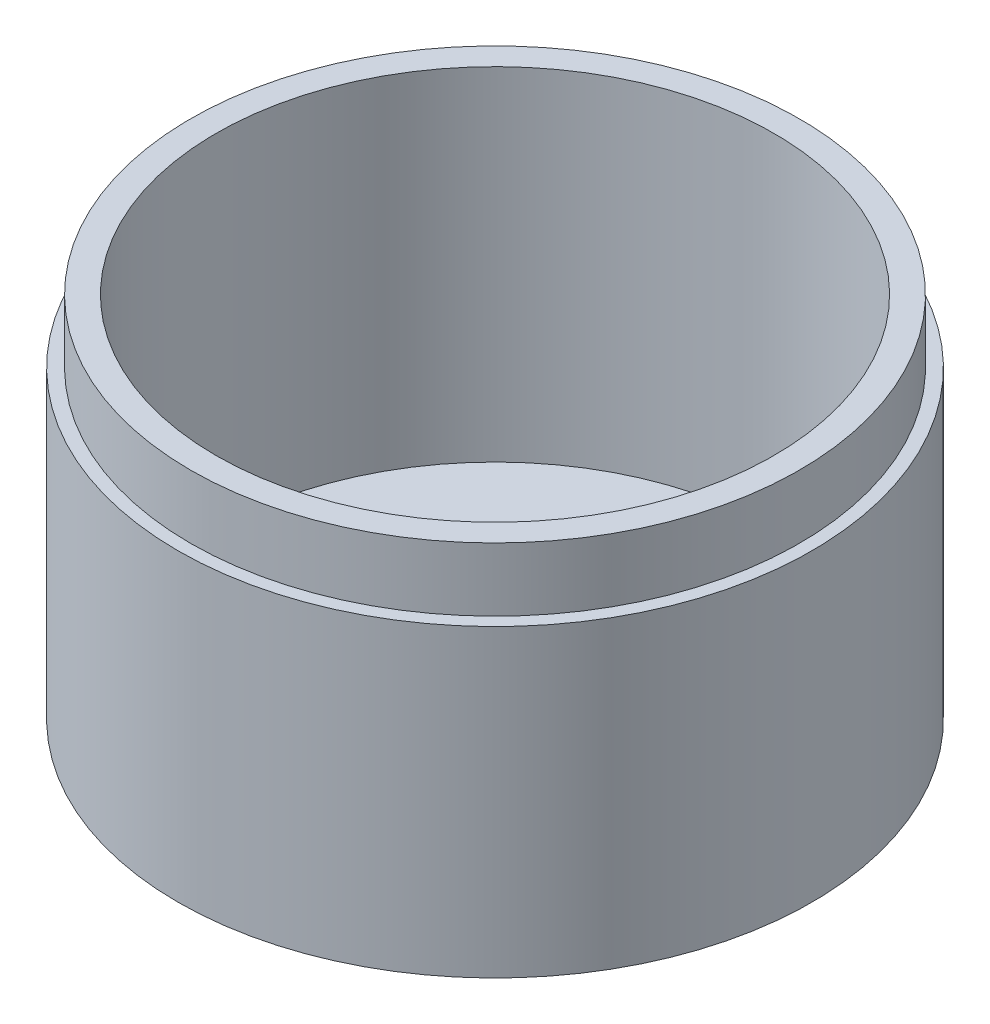
from build123d import *

# Parameters (mm, degrees)
SKETCH1_R           = 25
BOSS_EXTRUDE1_DEPTH = 29
CUT_EXTRUDE1_START  = -5
SKETCH2_R           = 25
SKETCH2_R_2         = 24
CUT_EXTRUDE1_DEPTH  = 5
SKETCH3_R           = 22
CUT_EXTRUDE2_DEPTH  = 27


with BuildPart() as part:
    # Sketch1 → Boss-Extrude1 (new body)
    with BuildSketch(Plane(origin=(0, 0, 0), x_dir=(1, 0, 0), z_dir=(0, 1, 0))):
        with Locations(Location((0, 0, 0), (0, 0, 270))):
            Circle(SKETCH1_R)
    extrude(amount=BOSS_EXTRUDE1_DEPTH)

    # Sketch2 → Cut-Extrude1 (cut)
    with BuildSketch(Plane(origin=(0, 29, 0), x_dir=(1, 0, 0), z_dir=(0, 1, 0)).offset(CUT_EXTRUDE1_START)):
        with Locations(Location((0, 0, 0), (0, 0, 270))):
            Circle(SKETCH2_R)
        with Locations(Location((0, 0, 0), (0, 0, 270))):
            Circle(SKETCH2_R_2, mode=Mode.SUBTRACT)
    extrude(amount=CUT_EXTRUDE1_DEPTH, mode=Mode.SUBTRACT)

    # Sketch3 → Cut-Extrude2 (cut)
    with BuildSketch(Plane(origin=(0, 29, 0), x_dir=(1, 0, 0), z_dir=(0, 1, 0))):
        with Locations(Location((0, 0, 0), (0, 0, 270))):
            Circle(SKETCH3_R)
    extrude(amount=-CUT_EXTRUDE2_DEPTH, mode=Mode.SUBTRACT)


solid = part.part
